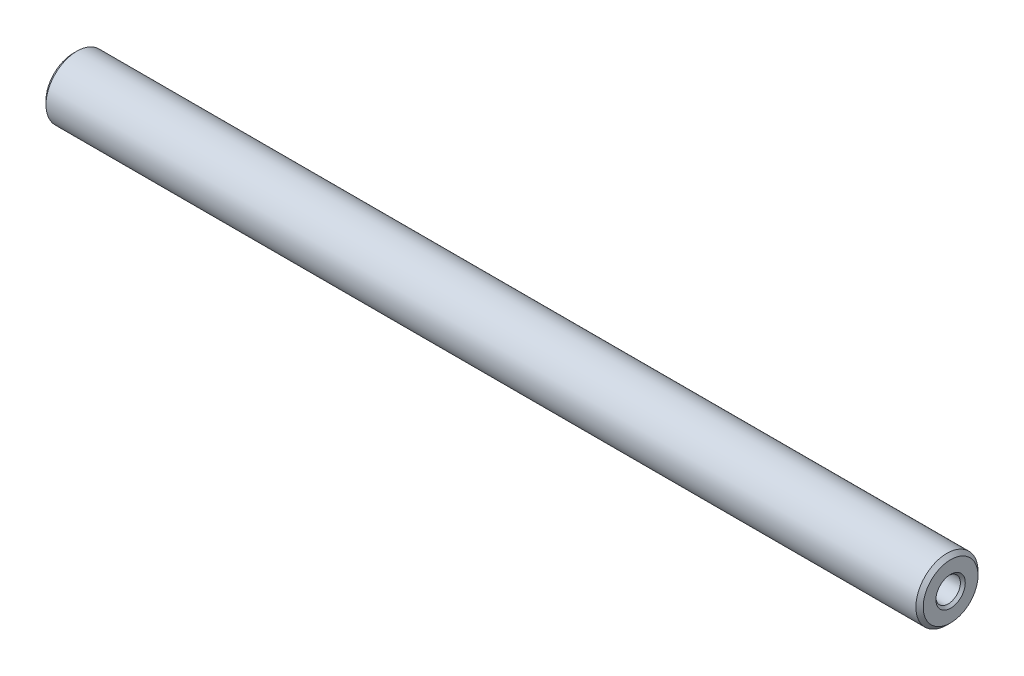
from build123d import *

# Parameters (mm, degrees)
SKETCH2_R           = 12.7
BOSS_EXTRUDE1_DEPTH = 179.3
CHAMFER1_SIZE       = 1.5


with BuildPart() as part:
    # Sketch2 → Boss-Extrude1 (new, symmetric)
    with BuildSketch(Plane(origin=(0, 0, 0), x_dir=(0, 0, -1), z_dir=(1, 0, 0))):
        Circle(SKETCH2_R)
    extrude(amount=BOSS_EXTRUDE1_DEPTH, both=True)

    # Chamfer1
    chamfer1_edges = [part.edges().sort_by_distance(p)[0] for p in [
        (-179.3, 0, 12.7),
        (179.3, 0, 12.7),
    ]]
    chamfer(chamfer1_edges, length=CHAMFER1_SIZE)

    # Sketch5 → M10 Tapped Hole1 (revolve, cut)
    with BuildSketch(Plane(origin=(179.3, 0, 0), x_dir=(0, 0, -1), z_dir=(0, 1, 0))):
        Polygon((0, 0), (0, 27.053657631), (4.25, 24.5), (4.25, 20), (5, 20), (5, 1), (6, 0), align=None)
    m10_tapped_hole1 = revolve(axis=Axis((185.65, 0, 0), (-1, 0, 0)), mode=Mode.SUBTRACT)

    # Mirror1: M10 Tapped Hole1 across plane
    add(m10_tapped_hole1.mirror(Plane(origin=(0, 0, 0), x_dir=(0, 0, 1), z_dir=(1, 0, 0))), mode=Mode.SUBTRACT)


solid = part.part
